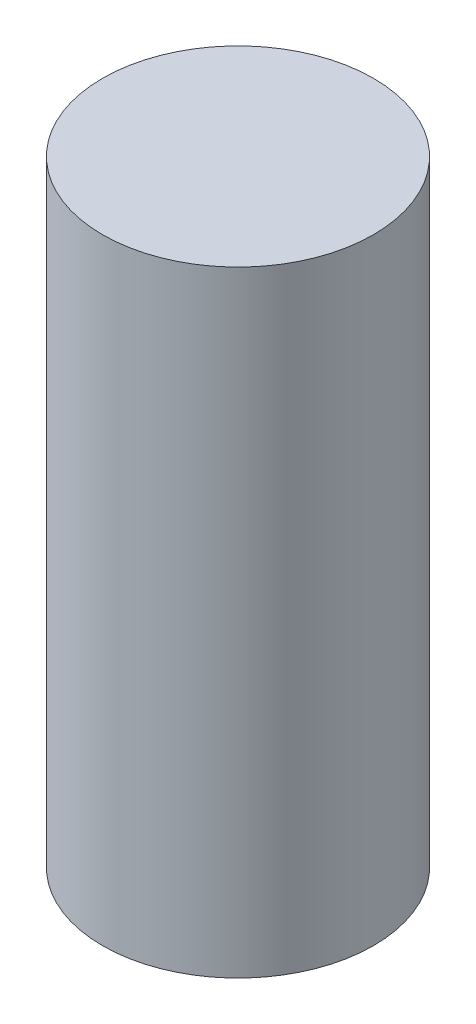
from build123d import *

# Parameters (mm, degrees)
IZIM1_R                     = 11
Y_KSEKLIK_EKSTR_ZYON1_DEPTH = 50


with BuildPart() as part:
    # Çizim1 → Yükseklik-Ekstrüzyon1 (new body)
    with BuildSketch(Plane(origin=(0, 0, 0), x_dir=(1, 0, 0), z_dir=(0, 1, 0))):
        with Locations(Location((0, 0, 0), (0, 0, 270))):
            Circle(IZIM1_R)
    extrude(amount=Y_KSEKLIK_EKSTR_ZYON1_DEPTH)


solid = part.part
